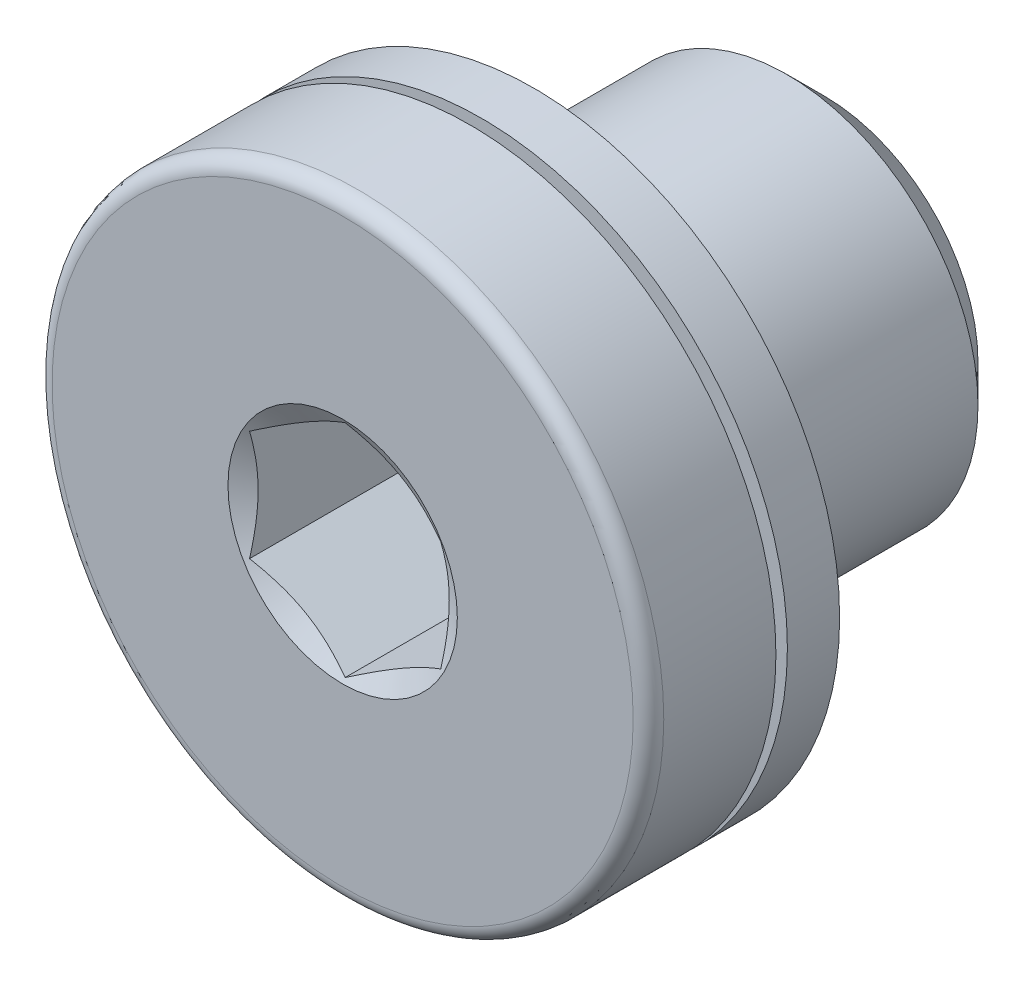
from build123d import *

# Parameters (mm, degrees)
SCHNITT_LINEAR_AUSTRAGEN1_DEPTH = 2.5


with BuildPart() as part:
    # Skizze1 → Rotation1 (revolve)
    with BuildSketch(Plane(origin=(0, 0, 0), x_dir=(0, 0, -1), z_dir=(1, 0, 0))):
        with BuildLine():
            Line((-1.633974596, 0), (-2.5, 1.5))
            Line((-2.5, 1.5), (-2.5, 3.8))
            ThreePointArc((-2.5, 3.8), (-2.441421356, 3.941421356), (-2.3, 4))
            Line((-2.3, 4), (-0.833333333, 4))
            Line((-0.833333333, 4), (-0.833333333, 3.6))
            Line((-0.833333333, 3.6), (-0.683333333, 3.6))
            Line((-0.683333333, 3.6), (-0.683333333, 4))
            Line((-0.683333333, 4), (0, 4))
            Line((0, 4), (0, 2.0095))
            Line((0, 2.0095), (0.4905, 2.5))
            Line((0.4905, 2.5), (3.3095, 2.5))
            Line((3.3095, 2.5), (3.8, 2.0095))
            Line((3.8, 2.0095), (3.8, 0))
            Line((3.8, 0), (-1.633974596, 0))
        make_face()
    revolve(axis=Axis((0, 0, -3.8), (0, 0, 1)))

    # Skizze2 → Schnitt-Linear austragen1 (cut)
    with BuildSketch(Plane.XY.offset(2.5)):
        Polygon((-1.25, -0.721687836), (0, -1.443375673), (1.25, -0.721687836), (1.25, 0.721687836), (0, 1.443375673), (-1.25, 0.721687836), align=None)
    extrude(amount=-SCHNITT_LINEAR_AUSTRAGEN1_DEPTH, mode=Mode.SUBTRACT)


solid = part.part
